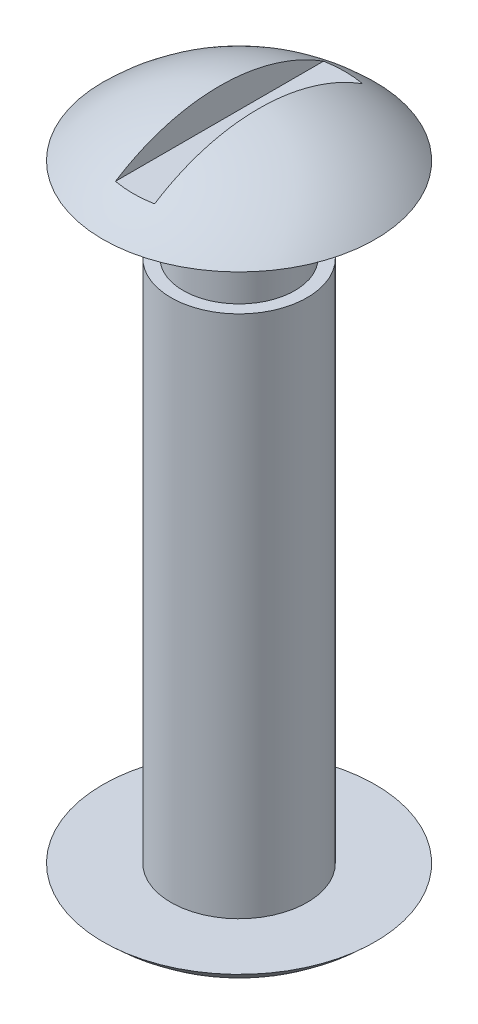
from build123d import *

# Parameters (mm, degrees)
CUT_EXTRUDE1_DEPTH      = 26.150502324
CUT_EXTRUDE1_DEPTH_BACK = 26.150502324
SKETCH2_W               = 1.4224
SKETCH2_H               = 1.27


with BuildPart() as part:
    # Sketch1 → Revolve1 (revolve)
    with BuildSketch(Plane.XY, mode=Mode.PRIVATE) as revolve1_sk:
        with BuildLine():
            Line((4.953, 22.1234), (2.032, 22.1234))
            Line((2.032, 22.1234), (2.032, 19.05))
            Line((2.032, 19.05), (2.4765, 19.05))
            Line((2.4765, 19.05), (2.4765, 0))
            Line((2.4765, 0), (4.953, 0))
            ThreePointArc((4.953, 0), (2.676809341, -1.50425402), (0, -2.032))
            Line((0, -2.032), (0, 24.1554))
            ThreePointArc((0, 24.1554), (2.676809341, 23.62765402), (4.953, 22.1234))
        make_face()
    revolve(revolve1_sk.sketch.rotate(Axis((0, 24.1554, 0), (0, -1, 0)), 180), axis=Axis((0, 24.1554, 0), (0, -1, 0)))

    # Sketch2 → Cut-Extrude1 (cut, two sides: drawn at the far end of the back side and taken through both)
    with BuildSketch(Plane.XY.offset(-CUT_EXTRUDE1_DEPTH_BACK)):
        with Locations((0, 23.6474)):
            Rectangle(SKETCH2_W, SKETCH2_H)
    extrude(amount=CUT_EXTRUDE1_DEPTH + CUT_EXTRUDE1_DEPTH_BACK, mode=Mode.SUBTRACT)


solid = part.part
